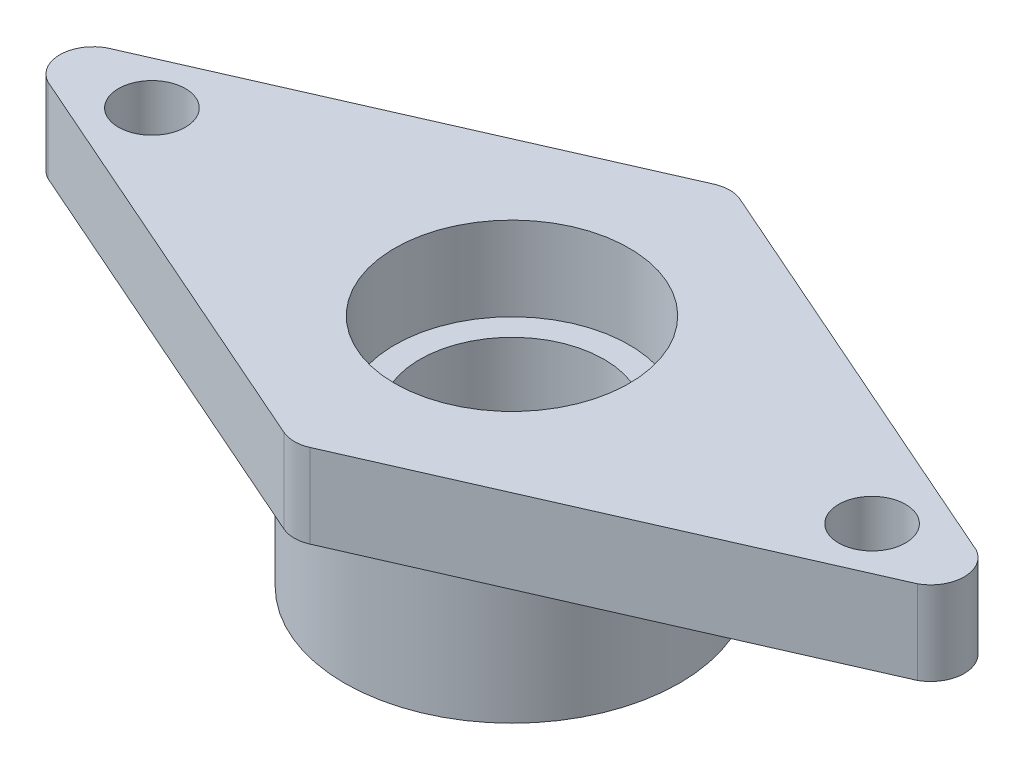
from build123d import *

# Parameters (mm, degrees)
SKETCH3_R           = 7
SKETCH3_R_2         = 2
BOSS_EXTRUDE1_DEPTH = 5


with BuildPart() as part:
    # Sketch2 → Revolve1 (revolve)
    with BuildSketch(Plane.XY, mode=Mode.PRIVATE) as revolve1_sk:
        Polygon((5.5, 0), (10, 0), (10, -9), (5.5, -6.5), align=None)
    revolve(revolve1_sk.sketch.rotate(Axis((0, 0, 0), (0, 1, 0)), 90), axis=Axis((0, 0, 0), (0, 1, 0)))

    # Sketch3 → Boss-Extrude1 (add)
    with BuildSketch(Plane(origin=(0, 0, 0), x_dir=(1, 0, 0), z_dir=(0, 1, 0))):
        with BuildLine():
            Line((-0.780909149, 12.835767591), (-25.956866437, 1.756247881))
            ThreePointArc((-25.956866437, 1.756247881), (-27, 0), (-25.956866437, -1.756247881))
            Line((-25.956866437, -1.756247881), (-0.780909149, -12.835767591))
            ThreePointArc((-0.780909149, -12.835767591), (-0.398996047, -12.958497669), (0, -13))
            ThreePointArc((0, -13), (0.398996047, -12.958497669), (0.780909149, -12.835767591))
            Line((0.780909149, -12.835767591), (25.956866437, -1.756247881))
            ThreePointArc((25.956866437, -1.756247881), (27, 0), (25.956866437, 1.756247881))
            Line((25.956866437, 1.756247881), (0.780909149, 12.835767591))
            ThreePointArc((0.780909149, 12.835767591), (0.398996047, 12.958497669), (0, 13))
            ThreePointArc((0, 13), (-0.398996047, 12.958497669), (-0.780909149, 12.835767591))
        make_face()
        with Locations(Location((0, 0, 0), (0, 0, 270))):
            Circle(SKETCH3_R, mode=Mode.SUBTRACT)
        with Locations(Location((21.5, 0, 0), (0, 0, 270))):
            Circle(SKETCH3_R_2, mode=Mode.SUBTRACT)
        with Locations(Location((-21.5, 0, 0), (0, 0, 270))):
            Circle(SKETCH3_R_2, mode=Mode.SUBTRACT)
    extrude(amount=BOSS_EXTRUDE1_DEPTH)


solid = part.part
